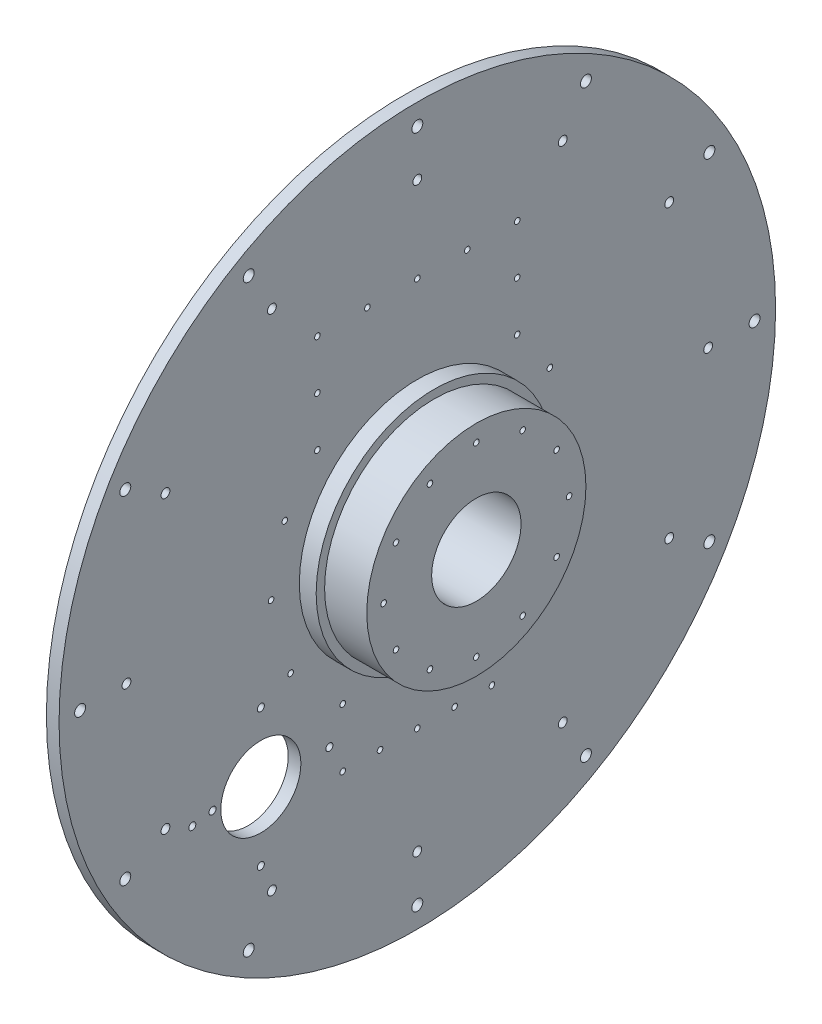
from build123d import *

# Parameters (mm, degrees)
SKETCH1_W                    = 15
SKETCH1_H                    = 425
SKETCH2_R                    = 140
BOSS_EXTRUDE1_DEPTH          = 20
SKETCH3_R                    = 130
BOSS_EXTRUDE2_DEPTH          = 50
SKETCH4_R                    = 85
BOSS_EXTRUDE3_DEPTH          = 23
F_1_4_CLEARANCE_HOLE1_D      = 6.647
F_1_4_CLEARANCE_HOLE1_DEPTH  = 85
HOLE1_D                      = 13
HOLE1_DEPTH                  = 85
HOLE1_TIP                    = 3.905594024
HOLE2_D                      = 10.5
HOLE2_DEPTH                  = 85
HOLE2_TIP                    = 3.15451825
F_5_16_CLEARANCE_HOLE1_D     = 8.376
F_5_16_CLEARANCE_HOLE1_DEPTH = 85
HOLE3_D                      = 95
HOLE3_DEPTH                  = 38
HOLE4_D                      = 106
HOLE4_CBORE_D                = 120
HOLE4_CBORE_DEPTH            = 28.979995345


with BuildPart() as part:
    # Sketch1 → Revolve1 (revolve)
    with BuildSketch(Plane.XY):
        with Locations((7.5, 212.5)):
            Rectangle(SKETCH1_W, SKETCH1_H)
    revolve(axis=Axis((0, 0, 0), (1, 0, 0)))

    # Sketch2 → Boss-Extrude1 (add)
    with BuildSketch(Plane(origin=(15, 0, 0), x_dir=(0, 0, -1), z_dir=(1, 0, 0))):
        Circle(SKETCH2_R)
    extrude(amount=BOSS_EXTRUDE1_DEPTH)

    # Sketch3 → Boss-Extrude2 (add)
    with BuildSketch(Plane(origin=(35, 0, 0), x_dir=(0, 0, -1), z_dir=(1, 0, 0))):
        Circle(SKETCH3_R)
    extrude(amount=BOSS_EXTRUDE2_DEPTH)

    # Sketch4 → Boss-Extrude3 (add)
    with BuildSketch(Plane.ZY):
        Circle(SKETCH4_R)
    extrude(amount=BOSS_EXTRUDE3_DEPTH)

    # Sketch5 → Cut-Revolve1 (revolve, cut)
    with BuildSketch(Plane(origin=(0, 0, 0), x_dir=(-1, 0, 0), z_dir=(0, 0, -1))):
        Polygon((-85, 113.3235), (-85, 110), (-67, 110), (-68.996960267, 113.3235), (-73, 113.3235), align=None)
    revolve(axis=Axis((85, 110, 0), (-1, 0, 0)), mode=Mode.SUBTRACT)

    # Sketch6 → Cut-Revolve2 (revolve, cut)
    with BuildSketch(Plane(origin=(0, 0, -55), x_dir=(-1, 0, 0), z_dir=(0, 0, -1))):
        Polygon((-85, 98.586294416), (-85, 95.262794416), (-67, 95.262794416), (-68.996960267, 98.586294416), (-73, 98.586294416), align=None)
    revolve(axis=Axis((85, 95.262794416, -55), (-1, 0, 0)), mode=Mode.SUBTRACT)

    # Sketch7 → Cut-Revolve3 (revolve, cut)
    with BuildSketch(Plane(origin=(0, 0, -95.262794416), x_dir=(-1, 0, 0), z_dir=(0, 0, -1))):
        Polygon((-85, 58.3235), (-85, 55), (-67, 55), (-68.996960267, 58.3235), (-73, 58.3235), align=None)
    revolve(axis=Axis((85, 55, -95.262794416), (-1, 0, 0)), mode=Mode.SUBTRACT)

    # Sketch8 → Cut-Revolve4 (revolve, cut)
    with BuildSketch(Plane(origin=(0, 0, -110), x_dir=(-1, 0, 0), z_dir=(0, 0, -1))):
        Polygon((-85, 3.3235), (-85, 0), (-67, 0), (-68.996960267, 3.3235), (-73, 3.3235), align=None)
    revolve(axis=Axis((85, 0, -110), (-1, 0, 0)), mode=Mode.SUBTRACT)

    # Sketch9 → Cut-Revolve5 (revolve, cut)
    with BuildSketch(Plane(origin=(0, 0, -95.262794416), x_dir=(-1, 0, 0), z_dir=(0, 0, -1))):
        Polygon((-85, -51.6765), (-85, -55), (-67, -55), (-68.996960267, -51.6765), (-73, -51.6765), align=None)
    revolve(axis=Axis((85, -55, -95.262794416), (-1, 0, 0)), mode=Mode.SUBTRACT)

    # Sketch10 → Cut-Revolve6 (revolve, cut)
    with BuildSketch(Plane(origin=(0, 0, -55), x_dir=(-1, 0, 0), z_dir=(0, 0, -1))):
        Polygon((-85, -91.939294416), (-85, -95.262794416), (-67, -95.262794416), (-68.996960267, -91.939294416), (-73, -91.939294416), align=None)
    revolve(axis=Axis((85, -95.262794416, -55), (-1, 0, 0)), mode=Mode.SUBTRACT)

    # Sketch11 → Cut-Revolve7 (revolve, cut)
    with BuildSketch(Plane(origin=(0, 0, 0), x_dir=(-1, 0, 0), z_dir=(0, 0, -1))):
        Polygon((-85, -106.6765), (-85, -110), (-67, -110), (-68.996960267, -106.6765), (-73, -106.6765), align=None)
    revolve(axis=Axis((85, -110, 0), (-1, 0, 0)), mode=Mode.SUBTRACT)

    # Sketch12 → Cut-Revolve8 (revolve, cut)
    with BuildSketch(Plane(origin=(0, 0, 55), x_dir=(-1, 0, 0), z_dir=(0, 0, -1))):
        Polygon((-85, -91.939294416), (-85, -95.262794416), (-67, -95.262794416), (-68.996960267, -91.939294416), (-73, -91.939294416), align=None)
    revolve(axis=Axis((85, -95.262794416, 55), (-1, 0, 0)), mode=Mode.SUBTRACT)

    # Sketch13 → Cut-Revolve9 (revolve, cut)
    with BuildSketch(Plane(origin=(0, 0, 95.262794416), x_dir=(-1, 0, 0), z_dir=(0, 0, -1))):
        Polygon((-85, -51.6765), (-85, -55), (-67, -55), (-68.996960267, -51.6765), (-73, -51.6765), align=None)
    revolve(axis=Axis((85, -55, 95.262794416), (-1, 0, 0)), mode=Mode.SUBTRACT)

    # Sketch14 → Cut-Revolve10 (revolve, cut)
    with BuildSketch(Plane(origin=(0, 0, 110), x_dir=(-1, 0, 0), z_dir=(0, 0, -1))):
        Polygon((-85, 3.3235), (-85, 0), (-67, 0), (-68.996960267, 3.3235), (-73, 3.3235), align=None)
    revolve(axis=Axis((85, 0, 110), (-1, 0, 0)), mode=Mode.SUBTRACT)

    # Sketch15 → Cut-Revolve11 (revolve, cut)
    with BuildSketch(Plane(origin=(0, 0, 95.262794416), x_dir=(-1, 0, 0), z_dir=(0, 0, -1))):
        Polygon((-85, 58.3235), (-85, 55), (-67, 55), (-68.996960267, 58.3235), (-73, 58.3235), align=None)
    revolve(axis=Axis((85, 55, 95.262794416), (-1, 0, 0)), mode=Mode.SUBTRACT)

    # Sketch16 → Cut-Revolve12 (revolve, cut)
    with BuildSketch(Plane(origin=(0, 0, 55), x_dir=(-1, 0, 0), z_dir=(0, 0, -1))):
        Polygon((-85, 98.586294416), (-85, 95.262794416), (-67, 95.262794416), (-68.996960267, 98.586294416), (-73, 98.586294416), align=None)
    revolve(axis=Axis((85, 95.262794416, 55), (-1, 0, 0)), mode=Mode.SUBTRACT)

    # 1/4 Clearance Hole1
    with Locations(Plane.ZY):
        with Locations((88.5, -218.5), (88.5, -149.231363996), (44.25, -218.5), (0, -218.5), (-44.25, -218.5), (150.255407557, -86.75), (-88.5, -218.5), (-88.5, -149.231363996), (-173.5, 0), (-150.255407557, -86.75), (-157.244401051, 73.324268412), (-118.5, 126.7280553), (-118.5, 185.11402765), (-118.5, 243.5), (-59.25, 243.5), (0, 243.5), (59.25, 243.5), (118.5, 243.5), (118.5, 185.11402765), (118.5, 126.7280553), (157.244401051, 73.324268412), (173.5, 0)):
            Hole(F_1_4_CLEARANCE_HOLE1_D / 2, depth=F_1_4_CLEARANCE_HOLE1_DEPTH)

    # Hole1
    with Locations(Plane.ZY):
        with Locations((400, 0), (346.410161514, -200), (200, -346.410161514), (0, -400), (-200, -346.410161514), (-346.410161514, -200), (-400, 0), (-346.410161514, 200), (-200, 346.410161514), (0, 400), (200, 346.410161514), (346.410161514, 200)):
            Hole(HOLE1_D / 2, depth=HOLE1_DEPTH)
            with Locations((0, 0, -(HOLE1_DEPTH + HOLE1_TIP / 2))):  # 118° drill point
                Cone(0, HOLE1_D / 2, HOLE1_TIP, mode=Mode.SUBTRACT)

    # Hole2
    with Locations(Plane.ZY):
        with Locations((0, -345), (-172.5, -298.778764306), (-298.778764306, -172.5), (-345, 0), (-298.778764306, 172.5), (-172.5, 298.778764306), (0, 345), (172.5, 298.778764306), (298.778764306, 172.5), (345, 0), (298.778764306, -172.5), (172.5, -298.778764306)):
            Hole(HOLE2_D / 2, depth=HOLE2_DEPTH)
            with Locations((0, 0, -(HOLE2_DEPTH + HOLE2_TIP / 2))):  # 118° drill point
                Cone(0, HOLE2_D / 2, HOLE2_TIP, mode=Mode.SUBTRACT)

    # 5/16 Clearance Hole1
    with Locations(Plane.ZY):
        with Locations((266.932809898, -185.615530061), (185.615530061, -266.932809898), (104.298250225, -185.615530061), (185.615530061, -104.298250225), (185.615530061, -185.615530061), (242.974289503, -181.587786851)):
            Hole(F_5_16_CLEARANCE_HOLE1_D / 2, depth=F_5_16_CLEARANCE_HOLE1_DEPTH)

    # Hole3
    with Locations(Plane(origin=(15, 0, 0), x_dir=(0, 0, -1), z_dir=(1, 0, 0))):
        with Locations((-185.615530061, -185.615530061)):
            Hole(HOLE3_D / 2, depth=HOLE3_DEPTH)

    # Hole4 (through all)
    with Locations(Plane.ZY.offset(23)):
        with Locations((0, 0)):
            CounterBoreHole(HOLE4_D / 2, HOLE4_CBORE_D / 2, HOLE4_CBORE_DEPTH)


solid = part.part
